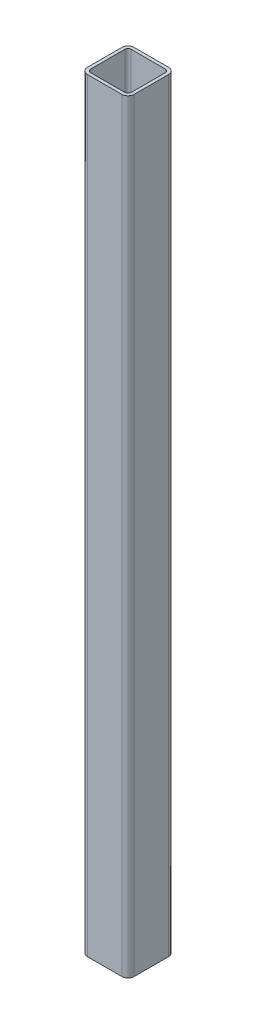
from build123d import *

# Parameters (mm, degrees)
EXTRUDE_1_DEPTH = 245


with BuildPart() as part:
    # 草图1 → 凸台-拉伸1 (new, symmetric)
    with BuildSketch(Plane(origin=(0, 0, 0), x_dir=(1, 0, 0), z_dir=(0, 1, 0))):
        with BuildLine():
            Line((-11, -15), (11, -15))
            ThreePointArc((11, -15), (13.828427125, -13.828427125), (15, -11))
            Line((15, -11), (15, 11))
            ThreePointArc((15, 11), (13.828427125, 13.828427125), (11, 15))
            Line((11, 15), (-11, 15))
            ThreePointArc((-11, 15), (-13.828427125, 13.828427125), (-15, 11))
            Line((-15, 11), (-15, -11))
            ThreePointArc((-15, -11), (-13.828427125, -13.828427125), (-11, -15))
        make_face()
        with BuildLine():
            Line((-11, -13), (11, -13))
            ThreePointArc((11, -13), (12.414213562, -12.414213562), (13, -11))
            Line((13, -11), (13, 11))
            ThreePointArc((13, 11), (12.414213562, 12.414213562), (11, 13))
            Line((11, 13), (-11, 13))
            ThreePointArc((-11, 13), (-12.414213562, 12.414213562), (-13, 11))
            Line((-13, 11), (-13, -11))
            ThreePointArc((-13, -11), (-12.414213562, -12.414213562), (-11, -13))
        make_face(mode=Mode.SUBTRACT)
    extrude(amount=EXTRUDE_1_DEPTH, both=True)


solid = part.part
